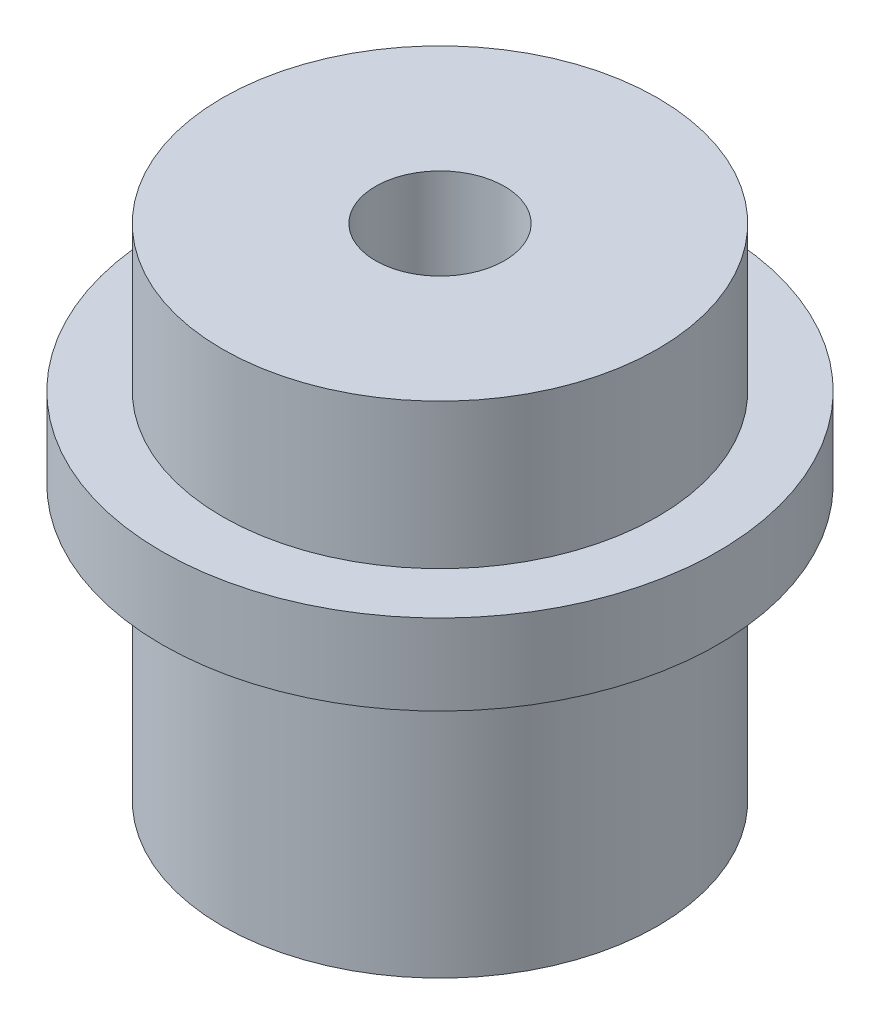
from build123d import *

# Parameters (mm, degrees)
BOSS_EXTRUDE1_DEPTH      = 11.43
BOSS_EXTRUDE1_DEPTH_BACK = 11.43
SKETCH1_R                = 17.145
SKETCH1_3_R              = 21.9075
SKETCH1_3_R_2            = 17.145
BOSS_EXTRUDE2_DEPTH      = 6.35
SKETCH1_4_R              = 17.145
BOSS_EXTRUDE3_DEPTH      = 27.94
CUT_EXTRUDE2_DEPTH       = 51.098642821
CUT_EXTRUDE2_DEPTH_BACK  = 51.098642821
SKETCH2_R                = 10.16
BOSS_EXTRUDE4_START      = -39.37
SKETCH3_R                = 10.16
SKETCH3_R_2              = 5.08
BOSS_EXTRUDE4_DEPTH      = 39.37


with BuildPart() as part:
    # Sketch1 → Boss-Extrude1 (new, two sides: drawn at the far end of the back side and taken through both)
    with BuildSketch(Plane(origin=(0, 0, 0), x_dir=(1, 0, 0), z_dir=(0, 1, 0)).offset(-BOSS_EXTRUDE1_DEPTH_BACK)):
        with Locations(Location((0, 0, 0), (0, 0, 270))):
            Circle(SKETCH1_R)
    extrude(amount=BOSS_EXTRUDE1_DEPTH + BOSS_EXTRUDE1_DEPTH_BACK)



with BuildPart() as body_2:
    # Sketch1<3> → Boss-Extrude2 (new body)
    with BuildSketch(Plane(origin=(0, 0, 0), x_dir=(1, 0, 0), z_dir=(0, 1, 0))):
        with Locations(Location((0, 0, 0), (0, 0, 270))):
            Circle(SKETCH1_3_R)
        with Locations(Location((0, 0, 0), (0, 0, 270))):
            Circle(SKETCH1_3_R_2, mode=Mode.SUBTRACT)
    extrude(amount=-BOSS_EXTRUDE2_DEPTH)


with BuildPart() as part_1:
    add(part.part)

    add(body_2.part)  # Boss-Extrude3 merges body 2
    # Sketch1<4> → Boss-Extrude3 (add)
    with BuildSketch(Plane(origin=(0, 0, 0), x_dir=(1, 0, 0), z_dir=(0, 1, 0))):
        with Locations(Location((0, 0, 0), (0, 0, 270))):
            Circle(SKETCH1_4_R)
    extrude(amount=-BOSS_EXTRUDE3_DEPTH)

    # Sketch2 → Cut-Extrude2 (cut, two sides: drawn at the far end of the back side and taken through both)
    with BuildSketch(Plane.XZ.offset(27.94).offset(-CUT_EXTRUDE2_DEPTH_BACK)):
        with Locations(Location((0, 0, 0), (0, 0, 270))):
            Circle(SKETCH2_R)
    extrude(amount=CUT_EXTRUDE2_DEPTH + CUT_EXTRUDE2_DEPTH_BACK, mode=Mode.SUBTRACT)

    # Sketch3 → Boss-Extrude4 (add)
    with BuildSketch(Plane(origin=(0, 11.43, 0), x_dir=(1, 0, 0), z_dir=(0, 1, 0)).offset(BOSS_EXTRUDE4_START)):
        Circle(SKETCH3_R)
        with Locations(Location((0, 0, 0), (0, 0, 270))):
            Circle(SKETCH3_R_2, mode=Mode.SUBTRACT)
    extrude(amount=BOSS_EXTRUDE4_DEPTH)


solid = part_1.part
